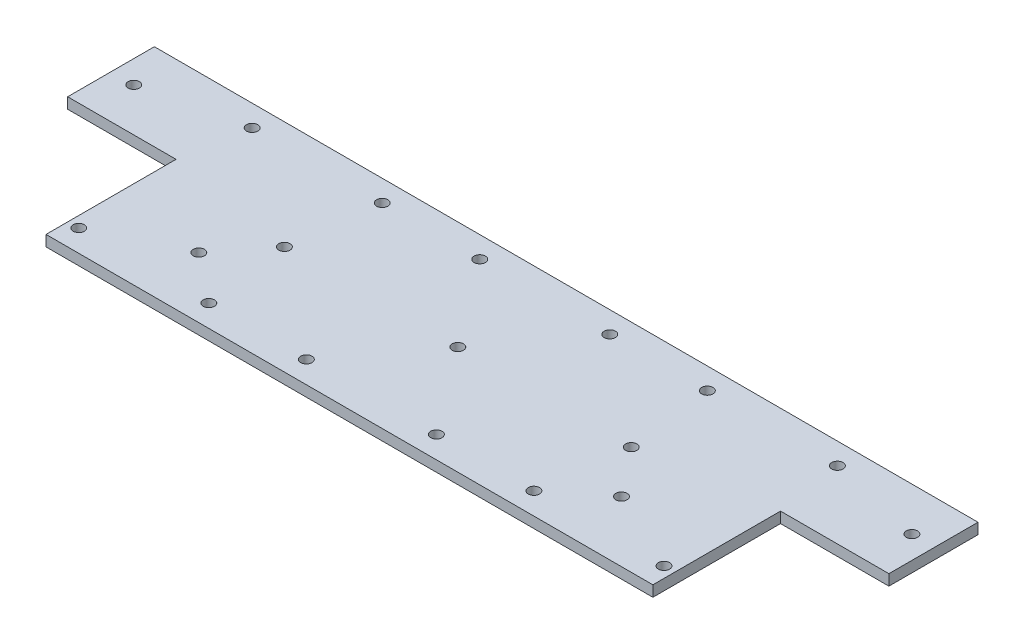
from build123d import *

# Parameters (mm, degrees)
BOSS_EXTRUDE2_DEPTH = 3.175
SKETCH5_R           = 1.651
CUT_EXTRUDE3_DEPTH  = 3.175
SKETCH6_R           = 1.651
CUT_EXTRUDE4_DEPTH  = 3.175
SKETCH7_R           = 1.651
CUT_EXTRUDE5_DEPTH  = 3.81
SKETCH8_R           = 1.651
CUT_EXTRUDE6_DEPTH  = 3.81


with BuildPart() as part:
    # Sketch4 → Boss-Extrude2 (new body)
    with BuildSketch(Plane(origin=(0, 0, 0), x_dir=(1, 0, 0), z_dir=(0, 1, 0))):
        Polygon((-113.15621118, 0), (128.14378882, 0), (128.14378882, -26.103364389), (96.39378882, -26.103364389), (96.39378882, -63.5), (-81.40621118, -63.5), (-81.40621118, -25.4), (-113.15621118, -25.4), align=None)
    extrude(amount=BOSS_EXTRUDE2_DEPTH)

    # Sketch5 → Cut-Extrude3 (cut)
    with BuildSketch(Plane(origin=(0, 3.175, 0), x_dir=(1, 0, 0), z_dir=(0, 1, 0))):
        with Locations(Location((7.49378882, -31.75, 0), (0, 0, 270))):
            Circle(SKETCH5_R)
        with Locations(Location((58.29378882, -31.75, 0), (0, 0, 270))):
            Circle(SKETCH5_R)
        with Locations(Location((-43.30621118, -31.75, 0), (0, 0, 270))):
            Circle(SKETCH5_R)
    extrude(amount=-CUT_EXTRUDE3_DEPTH, mode=Mode.SUBTRACT)

    # Sketch6 → Cut-Extrude4 (cut)
    with BuildSketch(Plane(origin=(0, 3.175, 0), x_dir=(1, 0, 0), z_dir=(0, 1, 0))):
        with Locations(Location((69.40628882, -45.72, 0), (0, 0, 270))):
            Circle(SKETCH6_R)
        with Locations(Location((-54.41871118, -45.72, 0), (0, 0, 270))):
            Circle(SKETCH6_R)
        with Locations(Location((121.47628882, -12.7, 0), (0, 0, 270))):
            Circle(SKETCH6_R)
        with Locations(Location((-106.48871118, -12.7, 0), (0, 0, 270))):
            Circle(SKETCH6_R)
    extrude(amount=-CUT_EXTRUDE4_DEPTH, mode=Mode.SUBTRACT)

    # Sketch7 → Cut-Extrude5 (cut)
    with BuildSketch(Plane(origin=(0, 3.175, 0), x_dir=(1, 0, 0), z_dir=(0, 1, 0))):
        with Locations(Location((93.21878882, -57.0738, 0), (0, 0, 270))):
            Circle(SKETCH7_R)
        with Locations(Location((55.11878882, -57.0738, 0), (0, 0, 270))):
            Circle(SKETCH7_R)
        with Locations(Location((26.54378882, -57.0738, 0), (0, 0, 270))):
            Circle(SKETCH7_R)
        with Locations(Location((-11.55621118, -57.0738, 0), (0, 0, 270))):
            Circle(SKETCH7_R)
        with Locations(Location((-40.13121118, -57.0738, 0), (0, 0, 270))):
            Circle(SKETCH7_R)
        with Locations(Location((-78.23121118, -57.0738, 0), (0, 0, 270))):
            Circle(SKETCH7_R)
    extrude(amount=-CUT_EXTRUDE5_DEPTH, mode=Mode.SUBTRACT)

    # Sketch8 → Cut-Extrude6 (cut)
    with BuildSketch(Plane(origin=(0, 3.175, 0), x_dir=(1, 0, 0), z_dir=(0, 1, 0))):
        with Locations(Location((93.21878882, -6.2738, 0), (0, 0, 270))):
            Circle(SKETCH8_R)
        with Locations(Location((55.11878882, -6.2738, 0), (0, 0, 270))):
            Circle(SKETCH8_R)
        with Locations(Location((26.54378882, -6.2738, 0), (0, 0, 270))):
            Circle(SKETCH8_R)
        with Locations(Location((-11.55621118, -6.2738, 0), (0, 0, 270))):
            Circle(SKETCH8_R)
        with Locations(Location((-40.13121118, -6.2738, 0), (0, 0, 270))):
            Circle(SKETCH8_R)
        with Locations(Location((-78.23121118, -6.2738, 0), (0, 0, 270))):
            Circle(SKETCH8_R)
    extrude(amount=-CUT_EXTRUDE6_DEPTH, mode=Mode.SUBTRACT)


solid = part.part
